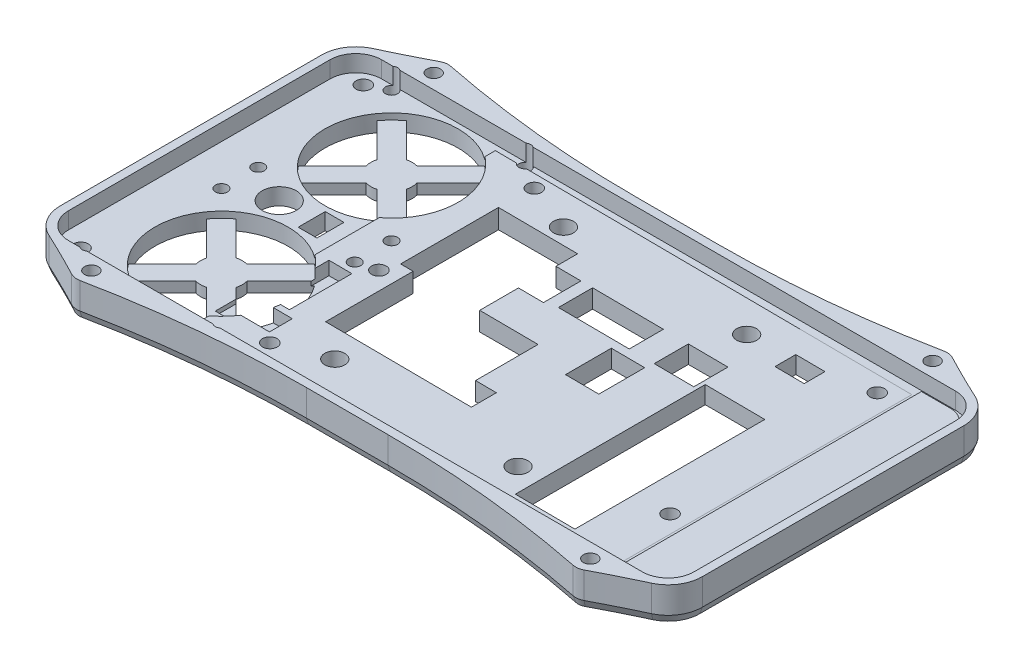
from build123d import *

# Parameters (mm, degrees)
EXTRUDE_1_DEPTH      = 4
EXTRUDE_START        = -2
EXTRUDE_11_DEPTH     = 71.2
SKETCH_2_R           = 2.4
CUT_EXTRUDE_1_DEPTH  = 10
EXTRUDE_9_DEPTH      = 5
EXTRUDE_1_2_DEPTH    = 8
SKETCH_4_R           = 2.4
SKETCH_4_W           = 14.3
SKETCH_4_H           = 45.6
SKETCH_4_W_2         = 17
SKETCH_4_H_2         = 8.2
SKETCH_4_W_3         = 9.5
SKETCH_4_W_4         = 8
SKETCH_4_H_3         = 11
SKETCH_4_W_5         = 7
SKETCH_4_H_4         = 5
CUT_EXTRUDE_2_DEPTH  = 171.57842771
SKETCH_2_11_R        = 4.1
SKETCH_2_11_W        = 4.5
SKETCH_2_11_H        = 6.5
CUT_EXTRUDE_3_DEPTH  = 171.57842771
SKETCH_2_13_R        = 1.75
CUT_EXTRUDE_4_DEPTH  = 171.57842771
CUT_EXTRUDE_START    = -1.5
SKETCH_2_14_W        = 5.5
SKETCH_2_14_H        = 15
SKETCH_2_14_W_2      = 13
SKETCH_2_14_H_2      = 5.5
CUT_EXTRUDE_5_DEPTH  = 170.07842771
SKETCH_6_R           = 3.5
SKETCH_6_R_2         = 1.65
EXTRUDE_10_DEPTH     = 8
SKETCH_6_2_R         = 1.65
CUT_EXTRUDE_9_DEPTH  = 173.893030513
FILLET_1_R           = 250
CHAMFER_1_SIZE       = 0.6
CHAMFER_1_SIZE2      = 1.648486452
SKETCH_8_R           = 1.45
CUT_EXTRUDE_10_DEPTH = 173.893030653
CUT_EXTRUDE_11_DEPTH = 10
SKETCH_10_R          = 16
CUT_EXTRUDE_12_DEPTH = 1.5


with BuildPart() as part:
    # 草图1 → Extrude 1 (new body)
    with BuildSketch(Plane(origin=(0, 0, 0), x_dir=(1, 0, 0), z_dir=(0, 1, 0))):
        with BuildLine():
            Line((6, 0.2), (143.8, 0.2))
            ThreePointArc((143.8, 0.2), (148.184062043, -1.615937957), (150, -6))
            Line((150, -6), (150, -68.8))
            ThreePointArc((150, -68.8), (148.184062043, -73.184062043), (143.8, -75))
            Line((143.8, -75), (6, -75))
            ThreePointArc((6, -75), (1.615937957, -73.184062043), (-0.2, -68.8))
            Line((-0.2, -68.8), (-0.2, -6))
            ThreePointArc((-0.2, -6), (1.615937957, -1.615937957), (6, 0.2))
        make_face()
    extrude(amount=EXTRUDE_1_DEPTH)

    # 草图7 → 凸台-拉伸11 (add)
    with BuildSketch(Plane(origin=(0, 0, -0.2), x_dir=(-1, 0, 0), z_dir=(0, 0, -1)).offset(EXTRUDE_START)):
        Polygon((-135.3, 4), (-35.3, 4.75), (-35.3, 4), align=None)
    extrude(amount=-EXTRUDE_11_DEPTH)

    # 草图2 → 切除-拉伸1 (cut)
    with BuildSketch(Plane(origin=(0, 0, 0), x_dir=(-1, 0, 0), z_dir=(0, -1, 0))):
        with Locations(Location((-103.2, -9.35, 0), (0, 0, 90))):
            Circle(SKETCH_2_R)
        with Locations(Location((-59.2, -9.35, 0), (0, 0, 90))):
            Circle(SKETCH_2_R)
        with Locations(Location((-59.2, -64.25, 0), (0, 0, 90))):
            Circle(SKETCH_2_R)
        with Locations(Location((-103.2, -64.25, 0), (0, 0, 90))):
            Circle(SKETCH_2_R)
    extrude(amount=-CUT_EXTRUDE_1_DEPTH, mode=Mode.SUBTRACT)

    # 草图3 → 凸台-拉伸9 (add)
    with BuildSketch(Plane(origin=(0, 0, 0), x_dir=(1, 0, 0), z_dir=(0, 1, 0))):
        with BuildLine():
            Line((136.8, -1), (136.8, -73.8))
            Line((136.8, -73.8), (143.8, -73.8))
            ThreePointArc((143.8, -73.8), (147.335533906, -72.335533906), (148.8, -68.8))
            Line((148.8, -68.8), (148.8, -6))
            ThreePointArc((148.8, -6), (147.335533906, -2.464466094), (143.8, -1))
            Line((143.8, -1), (136.8, -1))
        make_face()
    extrude(amount=EXTRUDE_9_DEPTH)

    # 草图1<2> → Extrude 1 2 (add)
    with BuildSketch(Plane(origin=(0, 0, 0), x_dir=(1, 0, 0), z_dir=(0, 1, 0))):
        with BuildLine():
            Line((6, 2.2), (143.8, 2.2))
            ThreePointArc((143.8, 2.2), (149.598275606, -0.201724394), (152, -6))
            Line((152, -6), (152, -68.8))
            ThreePointArc((152, -68.8), (149.598275606, -74.598275606), (143.8, -77))
            Line((143.8, -77), (6, -77))
            ThreePointArc((6, -77), (0.201724394, -74.598275606), (-2.2, -68.8))
            Line((-2.2, -68.8), (-2.2, -6))
            ThreePointArc((-2.2, -6), (0.201724394, -0.201724394), (6, 2.2))
        make_face()
        with BuildLine():
            Line((6, 0.2), (143.8, 0.2))
            ThreePointArc((143.8, 0.2), (148.184062043, -1.615937957), (150, -6))
            Line((150, -6), (150, -68.8))
            ThreePointArc((150, -68.8), (148.184062043, -73.184062043), (143.8, -75))
            Line((143.8, -75), (6, -75))
            ThreePointArc((6, -75), (1.615937957, -73.184062043), (-0.2, -68.8))
            Line((-0.2, -68.8), (-0.2, -6))
            ThreePointArc((-0.2, -6), (1.615937957, -1.615937957), (6, 0.2))
        make_face(mode=Mode.SUBTRACT)
    extrude(amount=EXTRUDE_1_2_DEPTH)

    # 草图4 → 切除-拉伸2 (cut, through all)
    with BuildSketch(Plane(origin=(0, 0, 0), x_dir=(1, 0, 0), z_dir=(0, 1, 0))):
        with Locations(Location((103.2, -64.25, 0), (0, 0, 90))):
            Circle(SKETCH_4_R)
        with Locations(Location((59.2, -64.25, 0), (0, 0, 90))):
            Circle(SKETCH_4_R)
        with Locations((115.75, -47.5)):
            Rectangle(SKETCH_4_W, SKETCH_4_H)
        with Locations((83.7, -22.45)):
            Rectangle(SKETCH_4_W_2, SKETCH_4_H_2)
        with Locations((102.95, -22.45)):
            Rectangle(SKETCH_4_W_3, SKETCH_4_H_2)
        Polygon((72.4, -27.35), (72.4, -18.35), (66.4, -18.35), (66.4, -13.15), (47.4, -13.15), (47.4, -36.65), (50.4, -36.65), (50.4, -57.65), (85.4, -57.65), (85.4, -51.65), (80.4, -51.65), (80.4, -36.65), (66.4, -36.65), (66.4, -27.35), align=None)
        with Locations((93.9, -34.05)):
            Rectangle(SKETCH_4_W_4, SKETCH_4_H_3)
        with Locations((116.7, -10.05)):
            Rectangle(SKETCH_4_W_5, SKETCH_4_H_4)
    extrude(amount=CUT_EXTRUDE_2_DEPTH, mode=Mode.SUBTRACT)

    # 草图2<11> → 切除-拉伸3 (cut, through all)
    with BuildSketch(Plane(origin=(0, 0, 0), x_dir=(-1, 0, 0), z_dir=(0, -1, 0))):
        with Locations(Location((-19, -37.4, 0), (0, 0, 90))):
            Circle(SKETCH_2_11_R)
        with Locations((-29.05, -37.4)):
            Rectangle(SKETCH_2_11_W, SKETCH_2_11_H)
    extrude(amount=-CUT_EXTRUDE_3_DEPTH, mode=Mode.SUBTRACT)

    # 草图2<13> → 切除-拉伸4 (cut, through all)
    with BuildSketch(Plane(origin=(0, 0, 0), x_dir=(-1, 0, 0), z_dir=(0, -1, 0))):
        with Locations(Location((-130.8, -5.6, 0), (0, 0, 90))):
            Circle(SKETCH_2_13_R)
        with Locations(Location((-131.1, -55.65, 0), (0, 0, 90))):
            Circle(SKETCH_2_13_R)
        with Locations(Location((-48.1, -68.75, 0), (0, 0, 90))):
            Circle(SKETCH_2_13_R)
        with Locations(Location((-5.05, -71.05, 0), (0, 0, 90))):
            Circle(SKETCH_2_13_R)
        with Locations(Location((-5.05, -3.25, 0), (0, 0, 90))):
            Circle(SKETCH_2_13_R)
        with Locations(Location((-47.7, -4.85, 0), (0, 0, 90))):
            Circle(SKETCH_2_13_R)
        with Locations(Location((-46.11, -40.57, 0), (0, 0, 90))):
            Circle(SKETCH_2_13_R)
    extrude(amount=-CUT_EXTRUDE_4_DEPTH, mode=Mode.SUBTRACT)

    # 草图2<14> → 切除-拉伸5 (cut, through all)
    with BuildSketch(Plane(origin=(0, 0, 0), x_dir=(-1, 0, 0), z_dir=(0, -1, 0)).offset(CUT_EXTRUDE_START)):
        with Locations((-40.85, -52.05)):
            Rectangle(SKETCH_2_14_W, SKETCH_2_14_H)
        with Locations((-39.3, -63.8)):
            Rectangle(SKETCH_2_14_W_2, SKETCH_2_14_H_2)
    extrude(amount=-CUT_EXTRUDE_5_DEPTH, mode=Mode.SUBTRACT)

    # 草图6 → 凸台-拉伸10 (add)
    # profile 1 of 4: a face of its own
    with BuildSketch(Plane(origin=(0, 0, 0), x_dir=(1, 0, 0), z_dir=(0, 1, 0))):
        with Locations((15, 3.7)):
            Circle(SKETCH_6_R)
        with Locations((15, 3.7)):
            Circle(SKETCH_6_R_2, mode=Mode.SUBTRACT)
    # profile 2 of 4: a face of its own
    with BuildSketch(Plane(origin=(0, 0, 0), x_dir=(1, 0, 0), z_dir=(0, 1, 0))):
        with Locations((15, -78.5)):
            Circle(SKETCH_6_R)
        with Locations((15, -78.5)):
            Circle(SKETCH_6_R_2, mode=Mode.SUBTRACT)
    # profile 3 of 4: a face of its own
    with BuildSketch(Plane(origin=(0, 0, 0), x_dir=(1, 0, 0), z_dir=(0, 1, 0))):
        with Locations((134.8, 3.7)):
            Circle(SKETCH_6_R)
        with Locations((134.8, 3.7)):
            Circle(SKETCH_6_R_2, mode=Mode.SUBTRACT)
    # profile 4 of 4: a face of its own
    with BuildSketch(Plane(origin=(0, 0, 0), x_dir=(1, 0, 0), z_dir=(0, 1, 0))):
        with Locations((134.8, -78.5)):
            Circle(SKETCH_6_R)
        with Locations((134.8, -78.5)):
            Circle(SKETCH_6_R_2, mode=Mode.SUBTRACT)
    extrude(amount=EXTRUDE_10_DEPTH)

    # 草图6<2> → 切除-拉伸9 (cut, through all)
    with BuildSketch(Plane(origin=(0, 0, 0), x_dir=(1, 0, 0), z_dir=(0, 1, 0))):
        with Locations(Location((15, 3.7, 0), (0, 0, 90))):
            Circle(SKETCH_6_2_R)
        with Locations(Location((134.8, 3.7, 0), (0, 0, 90))):
            Circle(SKETCH_6_2_R)
        with Locations(Location((134.8, -78.5, 0), (0, 0, 90))):
            Circle(SKETCH_6_2_R)
        with Locations(Location((15, -78.5, 0), (0, 0, 90))):
            Circle(SKETCH_6_2_R)
    extrude(amount=CUT_EXTRUDE_9_DEPTH, mode=Mode.SUBTRACT)

    # 圆角1
    fillet_1_edges = [part.edges().sort_by_distance(p)[0] for p in [
        (18.16227766, 4, 77),
        (11.83772234, 4, 77),
        (137.96227766, 4, 77),
        (131.63772234, 4, 77),
        (131.63772234, 4, -2.2),
        (137.96227766, 4, -2.2),
        (11.83772234, 4, -2.2),
        (18.16227766, 4, -2.2),
    ]]
    fillet(fillet_1_edges, radius=FILLET_1_R)

    # 倒角1
    chamfer_1_edges = [part.edges().sort_by_distance(p)[0] for p in [
        (14.502874151, 0, 81.964515246),
        (74.9, 0, 77),
        (135.297125849, 0, 81.964515246),
        (150.714252509, 0, 73.20830038),
        (135.297125849, 0, -7.164515246),
        (74.9, 0, -2.2),
        (14.502874151, 0, -7.164515246),
        (-0.914252509, 0, 1.59169962),
        (40.273083878, 0, 78.235796001),
        (7.988030543, 0, 78.850628869),
        (109.526916122, 0, 78.235796001),
        (141.811969457, 0, 78.850628869),
        (141.811969457, 0, -4.050628869),
        (109.526916122, 0, -3.435796001),
        (7.988030543, 0, -4.050628869),
        (40.273083878, 0, -3.435796001),
        (-2.2, 0, 37.4),
        (-0.914252509, 0, 73.20830038),
        (152, 0, 37.4),
        (150.714252509, 0, 1.59169962),
    ]]
    chamfer_1_side = [part.faces().sort_by_distance(p)[0] for p in [
        (0.58783664, 0, 72.250617658),
    ]]
    chamfer(chamfer_1_edges, length=CHAMFER_1_SIZE, length2=CHAMFER_1_SIZE2, reference=chamfer_1_side[0])

    # 草图8 → 切除-拉伸10 (cut, through all)
    with BuildSketch(Plane.XZ):
        with Locations(Location((41.552498021, 0.980721458, 0), (0, 0, 270))):
            Circle(SKETCH_8_R)
        with Locations(Location((41.552498021, 32.980721458, 0), (0, 0, 270))):
            Circle(SKETCH_8_R)
        with Locations(Location((9.552498021, 32.980721458, 0), (0, 0, 270))):
            Circle(SKETCH_8_R)
        with Locations(Location((9.552498021, 0.980721458, 0), (0, 0, 270))):
            Circle(SKETCH_8_R)
        with Locations(Location((9.552498021, 73.819278542, 0), (0, 0, 54.517284302))):
            Circle(SKETCH_8_R)
        with Locations(Location((9.552498021, 41.819278542, 0), (0, 0, 90))):
            Circle(SKETCH_8_R)
        with Locations((41.552498021, 41.819278542)):
            Circle(SKETCH_8_R)
        with Locations(Location((41.552498021, 73.819278542, 0), (0, 0, 325.596341786))):
            Circle(SKETCH_8_R)
    extrude(amount=-CUT_EXTRUDE_10_DEPTH, mode=Mode.SUBTRACT)

    # 草图9 → 切除-拉伸11 (cut)
    with BuildSketch(Plane.XZ):
        with BuildLine():
            ThreePointArc((34.959479388, 29.92323673), (25.552498021, 32.980721458), (16.145516655, 29.92323673))
            Line((16.145516655, 29.92323673), (24.258402796, 21.81035059))
            ThreePointArc((24.258402796, 21.81035059), (25.552498021, 21.980721458), (26.846593247, 21.81035059))
            Line((26.846593247, 21.81035059), (34.959479388, 29.92323673))
        make_face()
        with BuildLine():
            ThreePointArc((41.552498021, 16.980721458), (40.768940515, 21.926414314), (38.495013293, 26.387702825))
            Line((38.495013293, 26.387702825), (30.382127153, 18.274816684))
            ThreePointArc((30.382127153, 18.274816684), (30.509722328, 17.633352419), (30.552498021, 16.980721458))
            ThreePointArc((30.552498021, 16.980721458), (30.509722328, 16.328090497), (30.382127153, 15.686626233))
            Line((30.382127153, 15.686626233), (38.495013293, 7.573740092))
            ThreePointArc((38.495013293, 7.573740092), (40.768940515, 12.035028603), (41.552498021, 16.980721458))
        make_face()
        with BuildLine():
            Line((24.258402796, 12.151092327), (16.145516655, 4.038206186))
            ThreePointArc((16.145516655, 4.038206186), (25.552498021, 0.980721458), (34.959479388, 4.038206186))
            Line((34.959479388, 4.038206186), (26.846593247, 12.151092327))
            ThreePointArc((26.846593247, 12.151092327), (25.552498021, 11.980721458), (24.258402796, 12.151092327))
        make_face()
        with BuildLine():
            Line((20.72286889, 18.274816684), (12.609982749, 26.387702825))
            ThreePointArc((12.609982749, 26.387702825), (9.552498021, 16.980721458), (12.609982749, 7.573740092))
            Line((12.609982749, 7.573740092), (20.72286889, 15.686626233))
            ThreePointArc((20.72286889, 15.686626233), (20.552498021, 16.980721458), (20.72286889, 18.274816684))
        make_face()
        with BuildLine():
            ThreePointArc((12.609982749, 67.226259908), (9.552498021, 57.819278542), (12.609982749, 48.412297175))
            Line((12.609982749, 48.412297175), (20.72286889, 56.525183316))
            ThreePointArc((20.72286889, 56.525183316), (20.552498021, 57.819278542), (20.72286889, 59.113373767))
            Line((20.72286889, 59.113373767), (12.609982749, 67.226259908))
        make_face()
        with BuildLine():
            Line((26.846593247, 62.648907673), (34.959479388, 70.761793814))
            ThreePointArc((34.959479388, 70.761793814), (25.552498021, 73.819278542), (16.145516655, 70.761793814))
            Line((16.145516655, 70.761793814), (24.258402796, 62.648907673))
            ThreePointArc((24.258402796, 62.648907673), (25.552498021, 62.819278542), (26.846593247, 62.648907673))
        make_face()
        with BuildLine():
            Line((30.382127153, 56.525183316), (38.495013293, 48.412297175))
            ThreePointArc((38.495013293, 48.412297175), (40.768940515, 52.873585686), (41.552498021, 57.819278542))
            ThreePointArc((41.552498021, 57.819278542), (40.768940515, 62.764971397), (38.495013293, 67.226259908))
            Line((38.495013293, 67.226259908), (30.382127153, 59.113373767))
            ThreePointArc((30.382127153, 59.113373767), (30.509722328, 58.471909503), (30.552498021, 57.819278542))
            ThreePointArc((30.552498021, 57.819278542), (30.509722328, 57.166647581), (30.382127153, 56.525183316))
        make_face()
        with BuildLine():
            ThreePointArc((16.145516655, 44.87676327), (25.552498021, 41.819278542), (34.959479388, 44.87676327))
            Line((34.959479388, 44.87676327), (26.846593247, 52.98964941))
            ThreePointArc((26.846593247, 52.98964941), (25.552498021, 52.819278542), (24.258402796, 52.98964941))
            Line((24.258402796, 52.98964941), (16.145516655, 44.87676327))
        make_face()
    extrude(amount=-CUT_EXTRUDE_11_DEPTH, mode=Mode.SUBTRACT)

    # 草图10 → 切除-拉伸12 (cut, symmetric)
    with BuildSketch(Plane(origin=(0, 4, 0), x_dir=(1, 0, 0), z_dir=(0, 1, 0))):
        with Locations(Location((25.552498021, -16.980721458, 0), (0, 0, 53.989299345))):
            Circle(SKETCH_10_R)
        with Locations((25.552498021, -57.819278542)):
            Circle(SKETCH_10_R)
    extrude(amount=CUT_EXTRUDE_12_DEPTH, both=True, mode=Mode.SUBTRACT)


solid = part.part
